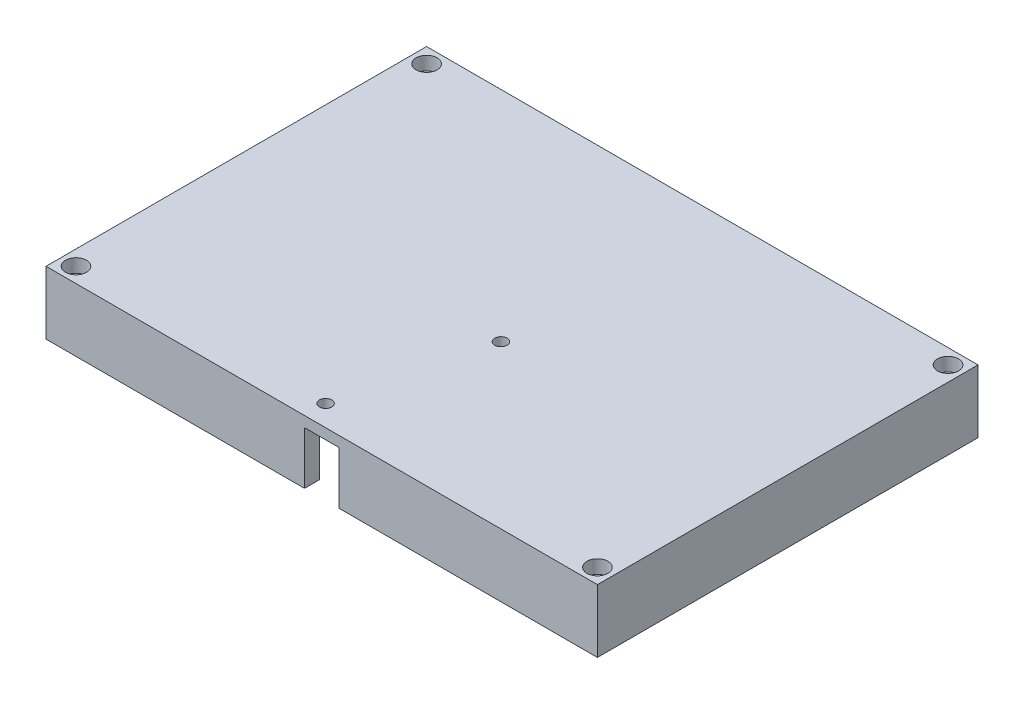
from build123d import *

# Parameters (mm, degrees)
SKETCH1_W           = 254
SKETCH1_H           = 127
BOSS_EXTRUDE2_DEPTH = 19.05
SKETCH2_W           = 244
SKETCH2_H           = 117
CUT_EXTRUDE1_DEPTH  = 17.05
SKETCH4_W           = 70
SKETCH4_H           = 127
CUT_EXTRUDE2_DEPTH  = 44
SKETCH6_W           = 5
SKETCH6_H           = 117
BOSS_EXTRUDE3_DEPTH = 17.05
SKETCH9_W           = 174
SKETCH9_H           = 117
BOSS_EXTRUDE4_DEPTH = 4
SKETCH12_W          = 8.5
SKETCH12_H          = 5
CUT_EXTRUDE3_DEPTH  = 13.05
CUT_EXTRUDE4_DEPTH  = 1
CUT_EXTRUDE5_DEPTH  = 4.5
SKETCH17_W          = 2.2
SKETCH17_H          = 51.1
CUT_EXTRUDE6_DEPTH  = 1.5
SKETCH19_W          = 7.4
SKETCH19_H          = 6
CUT_EXTRUDE7_DEPTH  = 4
SKETCH20_R          = 3.5
CUT_EXTRUDE8_DEPTH  = 2.5
SKETCH23_R          = 1.5
CUT_EXTRUDE9_DEPTH  = 38
BOSS_EXTRUDE5_DEPTH = 13.05
SKETCH25_W          = 9.3
SKETCH25_H          = 6
CUT_EXTRUDE10_DEPTH = 4
SKETCH26_W          = 8.5
SKETCH26_H          = 1.89071474
CUT_EXTRUDE11_DEPTH = 3.5
SKETCH27_R          = 0.95
CUT_EXTRUDE13_DEPTH = 25
SKETCH28_R          = 2.06
CUT_EXTRUDE18_DEPTH = 1.24
BOSS_EXTRUDE6_START = 2
SKETCH31_W          = 184
SKETCH31_H          = 127
SKETCH31_R          = 2.06
SKETCH31_R_2        = 3.5
BOSS_EXTRUDE6_DEPTH = 2
CUT_EXTRUDE19_REACH = 145.542
SKETCH14_W          = 11.462803728
SKETCH14_H          = 5


with BuildPart() as part:
    # Sketch1 → Boss-Extrude2 (new body)
    with BuildSketch(Plane(origin=(0, 0, 0), x_dir=(1, 0, 0), z_dir=(0, 1, 0))):
        Rectangle(SKETCH1_W, SKETCH1_H)
    extrude(amount=BOSS_EXTRUDE2_DEPTH)

    # Sketch2 → Cut-Extrude1 (cut)
    with BuildSketch(Plane.XZ):
        Rectangle(SKETCH2_W, SKETCH2_H)
    extrude(amount=-CUT_EXTRUDE1_DEPTH, mode=Mode.SUBTRACT)

    # Sketch4 → Cut-Extrude2 (cut)
    with BuildSketch(Plane(origin=(0, 19.05, 0), x_dir=(1, 0, 0), z_dir=(0, 1, 0))):
        with Locations((-92, 0)):
            Rectangle(SKETCH4_W, SKETCH4_H)
    extrude(amount=-CUT_EXTRUDE2_DEPTH, mode=Mode.SUBTRACT)

    # Sketch6 → Boss-Extrude3 (add)
    with BuildSketch(Plane.XZ.offset(-17.05)):
        with Locations((-54.5, 0)):
            Rectangle(SKETCH6_W, SKETCH6_H)
    extrude(amount=BOSS_EXTRUDE3_DEPTH)

    # Sketch9 → Boss-Extrude4 (add)
    with BuildSketch(Plane.XZ.offset(-17.05)):
        with Locations((35, 0)):
            Rectangle(SKETCH9_W, SKETCH9_H)
    extrude(amount=BOSS_EXTRUDE4_DEPTH)

    # Sketch12 → Cut-Extrude3 (cut)
    with BuildSketch(Plane.XZ):
        with Locations((35, 61)):
            Rectangle(SKETCH12_W, SKETCH12_H)
    extrude(amount=-CUT_EXTRUDE3_DEPTH, mode=Mode.SUBTRACT)

    # Sketch13 → Cut-Extrude4 (cut)
    with BuildSketch(Plane.XZ.offset(-13.05)):
        Polygon((30.75, 58.5), (24.45, 58.5), (24.45, 7.4), (45.55, 7.4), (45.55, 58.5), (39.25, 58.5), (39.25, 54), (30.75, 54), align=None)
    extrude(amount=-CUT_EXTRUDE4_DEPTH, mode=Mode.SUBTRACT)

    # Sketch15 → Cut-Extrude5 (cut)
    with BuildSketch(Plane.XZ.offset(-13.05)):
        Polygon((30.75, 54), (39.25, 54), (39.25, 58.5), (39.25, 63.5), (30.75, 63.5), (30.75, 58.5), align=None)
    extrude(amount=-CUT_EXTRUDE5_DEPTH, mode=Mode.SUBTRACT)

    # Sketch17 → Cut-Extrude6 (cut)
    with BuildSketch(Plane.XZ.offset(-14.05)):
        with Locations((25.55, 32.95)):
            Rectangle(SKETCH17_W, SKETCH17_H)
        with Locations((44.45, 32.95)):
            Rectangle(SKETCH17_W, SKETCH17_H)
    extrude(amount=-CUT_EXTRUDE6_DEPTH, mode=Mode.SUBTRACT)

    # Sketch19 → Cut-Extrude7 (cut)
    with BuildSketch(Plane.XZ.offset(-14.05)):
        with Locations((30.35, 46.5)):
            Rectangle(SKETCH19_W, SKETCH19_H)
    extrude(amount=-CUT_EXTRUDE7_DEPTH, mode=Mode.SUBTRACT)

    # Sketch20 → Cut-Extrude8 (cut)
    with BuildSketch(Plane(origin=(0, 19.05, 0), x_dir=(1, 0, 0), z_dir=(0, 1, 0))):
        with Locations(Location((-52, -58.5, 0), (0, 0, 270))):
            Circle(SKETCH20_R)
        with Locations(Location((122, -58.5, 0), (0, 0, 270))):
            Circle(SKETCH20_R)
        with Locations(Location((122, 58.5, 0), (0, 0, 270))):
            Circle(SKETCH20_R)
        with Locations(Location((-52, 58.5, 0), (0, 0, 270))):
            Circle(SKETCH20_R)
    extrude(amount=-CUT_EXTRUDE8_DEPTH, mode=Mode.SUBTRACT)

    # Sketch23 → Cut-Extrude9 (cut)
    with BuildSketch(Plane(origin=(0, 16.55, 0), x_dir=(1, 0, 0), z_dir=(0, 1, 0))):
        with Locations(Location((-52, 58.5, 0), (0, 0, 270))):
            Circle(SKETCH23_R)
        with Locations(Location((-52, -58.5, 0), (0, 0, 270))):
            Circle(SKETCH23_R)
        with Locations(Location((122, -58.5, 0), (0, 0, 270))):
            Circle(SKETCH23_R)
        with Locations(Location((122, 58.5, 0), (0, 0, 270))):
            Circle(SKETCH23_R)
    extrude(amount=-CUT_EXTRUDE9_DEPTH, mode=Mode.SUBTRACT)

    # Sketch24 → Boss-Extrude5 (add)
    with BuildSketch(Plane.XZ.offset(-13.05)):
        with BuildLine():
            Line((-52, 57), (-52, 55))
            ThreePointArc((-52, 55), (-49.525126266, 56.025126266), (-48.5, 58.5))
            Line((-48.5, 58.5), (-50.5, 58.5))
            ThreePointArc((-50.5, 58.5), (-50.939339828, 57.439339828), (-52, 57))
        make_face()
        with BuildLine():
            Line((-48.5, -58.5), (-50.5, -58.5))
            ThreePointArc((-50.5, -58.5), (-50.939339828, -57.439339828), (-52, -57))
            Line((-52, -57), (-52, -55))
            ThreePointArc((-52, -55), (-49.525126266, -56.025126266), (-48.5, -58.5))
        make_face()
        with BuildLine():
            Line((122, 55), (122, 57))
            ThreePointArc((122, 57), (120.939339828, 57.439339828), (120.5, 58.5))
            Line((120.5, 58.5), (118.5, 58.5))
            ThreePointArc((118.5, 58.5), (119.525126266, 56.025126266), (122, 55))
        make_face()
        with BuildLine():
            Line((122, -57), (122, -55))
            ThreePointArc((122, -55), (119.525126266, -56.025126266), (118.5, -58.5))
            Line((118.5, -58.5), (120.5, -58.5))
            ThreePointArc((120.5, -58.5), (120.939339828, -57.439339828), (122, -57))
        make_face()
    extrude(amount=BOSS_EXTRUDE5_DEPTH)

    # Sketch25 → Cut-Extrude10 (cut)
    with BuildSketch(Plane.XZ.offset(-14.05)):
        with Locations((38.7, 46.5)):
            Rectangle(SKETCH25_W, SKETCH25_H)
    extrude(amount=-CUT_EXTRUDE10_DEPTH, mode=Mode.SUBTRACT)

    # Sketch26 → Cut-Extrude11 (cut)
    with BuildSketch(Plane.XZ.offset(-14.05)):
        with Locations((35, 53.05464263)):
            Rectangle(SKETCH26_W, SKETCH26_H)
    extrude(amount=-CUT_EXTRUDE11_DEPTH, mode=Mode.SUBTRACT)

    # Sketch27 → Cut-Extrude13 (cut)
    with BuildSketch(Plane.XZ.offset(-14.05)):
        with Locations(Location((40.7, 9.4, 0), (0, 0, 270))):
            Circle(SKETCH27_R)
        with Locations(Location((29.3, 56.5, 0), (0, 0, 270))):
            Circle(SKETCH27_R)
    extrude(amount=-CUT_EXTRUDE13_DEPTH, mode=Mode.SUBTRACT)

    # Sketch28 → Cut-Extrude18 (cut)
    with BuildSketch(Plane(origin=(0, 19.05, 0), x_dir=(1, 0, 0), z_dir=(0, 1, 0))):
        with Locations(Location((40.7, -9.4, 0), (0, 0, 270))):
            Circle(SKETCH28_R)
        with Locations(Location((29.3, -56.5, 0), (0, 0, 270))):
            Circle(SKETCH28_R)
    extrude(amount=-CUT_EXTRUDE18_DEPTH, mode=Mode.SUBTRACT)

    # Sketch31 → Boss-Extrude6 (add)
    with BuildSketch(Plane(origin=(0, 19.05, 0), x_dir=(1, 0, 0), z_dir=(0, 1, 0)).offset(BOSS_EXTRUDE6_START)):
        with Locations((35, 0)):
            Rectangle(SKETCH31_W, SKETCH31_H)
        with Locations(Location((40.7, -9.4, 0), (0, 0, 270))):
            Circle(SKETCH31_R, mode=Mode.SUBTRACT)
        with Locations(Location((-52, 58.5, 0), (0, 0, 270))):
            Circle(SKETCH31_R_2, mode=Mode.SUBTRACT)
        with Locations(Location((-52, -58.5, 0), (0, 0, 270))):
            Circle(SKETCH31_R_2, mode=Mode.SUBTRACT)
        with Locations(Location((29.3, -56.5, 0), (0, 0, 270))):
            Circle(SKETCH31_R, mode=Mode.SUBTRACT)
        with Locations(Location((122, -58.5, 0), (0, 0, 270))):
            Circle(SKETCH31_R_2, mode=Mode.SUBTRACT)
        with Locations(Location((122, 58.5, 0), (0, 0, 270))):
            Circle(SKETCH31_R_2, mode=Mode.SUBTRACT)
    extrude(amount=-BOSS_EXTRUDE6_DEPTH)

    # Cut-Extrude19: up to this face of the body (flat: up to its plane)
    cut_extrude19_end = Plane(part.part.faces().sort_by_distance((35, 17.55, 57.80464263))[0])
    # Sketch14 → Cut-Extrude19 (cut, up to the picked face)
    with BuildSketch(Plane.XZ, mode=Mode.PRIVATE) as cut_extrude19_sk1:
        with Locations((35, 61)):
            Rectangle(SKETCH14_W, SKETCH14_H)
    cut_extrude19_tool1 = split(extrude(cut_extrude19_sk1.sketch, amount=-CUT_EXTRUDE19_REACH, mode=Mode.PRIVATE), bisect_by=cut_extrude19_end, keep=Keep.BOTH, mode=Mode.PRIVATE)
    add(cut_extrude19_tool1.solids().sort_by(Axis((35, 0, 61), (0, 1, 0)))[0], mode=Mode.SUBTRACT)


solid = part.part
